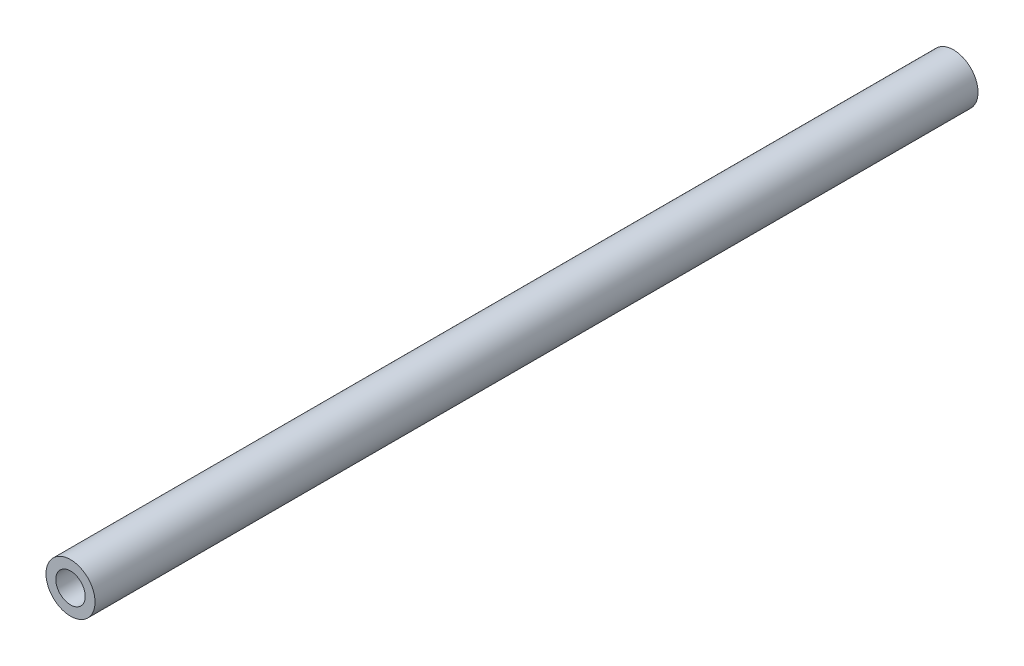
from build123d import *

# Parameters (mm, degrees)
SKETCH_1_R      = 2.5
SKETCH_1_R_2    = 1.5
EXTRUDE_1_DEPTH = 90


with BuildPart() as part:
    # 草图1 → 凸台-拉伸1 (new body)
    with BuildSketch(Plane.XY):
        with Locations(Location((0, 0, 0), (0, 0, 180))):
            Circle(SKETCH_1_R)
        with Locations(Location((0, 0, 0), (0, 0, 180))):
            Circle(SKETCH_1_R_2, mode=Mode.SUBTRACT)
    extrude(amount=EXTRUDE_1_DEPTH)


solid = part.part
